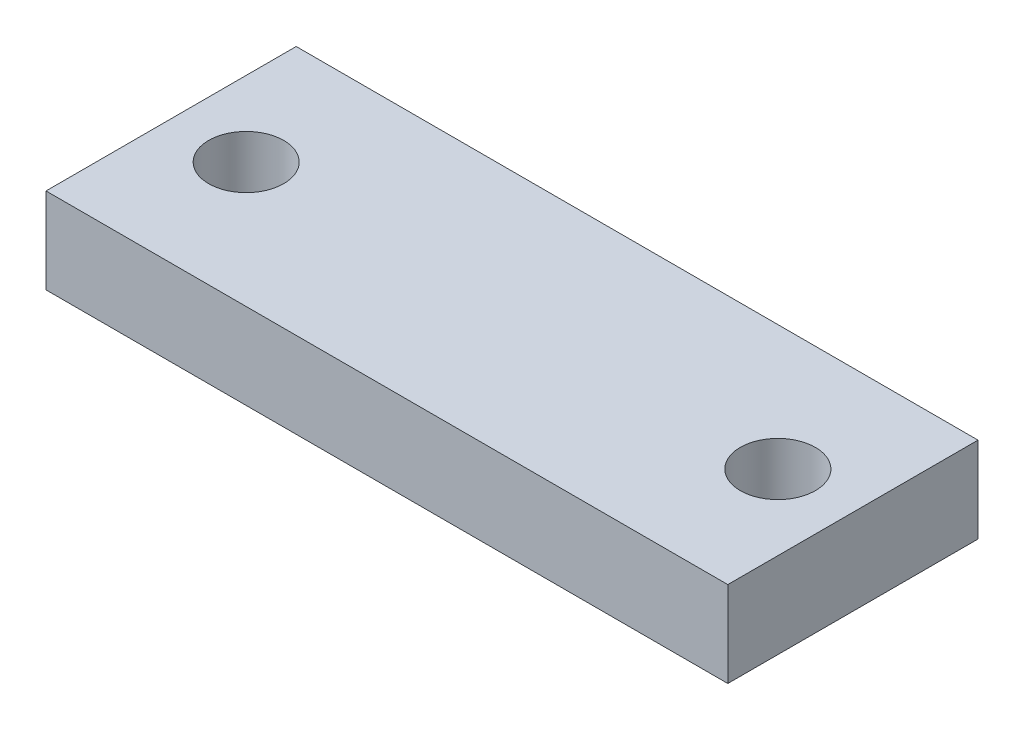
from build123d import *

# Parameters (mm, degrees)
SKETCH_1_W      = 54.5
SKETCH_1_H      = 20
SKETCH_1_R      = 3
EXTRUDE_1_DEPTH = 6.85


with BuildPart() as part:
    # 草图1 → 凸台-拉伸1 (new body)
    with BuildSketch(Plane(origin=(0, 0, 0), x_dir=(1, 0, 0), z_dir=(0, 1, 0))):
        with Locations((27.25, -10)):
            Rectangle(SKETCH_1_W, SKETCH_1_H)
        with Locations(Location((48.5, -10, 0), (0, 0, 90))):
            Circle(SKETCH_1_R, mode=Mode.SUBTRACT)
        with Locations(Location((6, -10, 0), (0, 0, 90))):
            Circle(SKETCH_1_R, mode=Mode.SUBTRACT)
    extrude(amount=EXTRUDE_1_DEPTH)


solid = part.part
